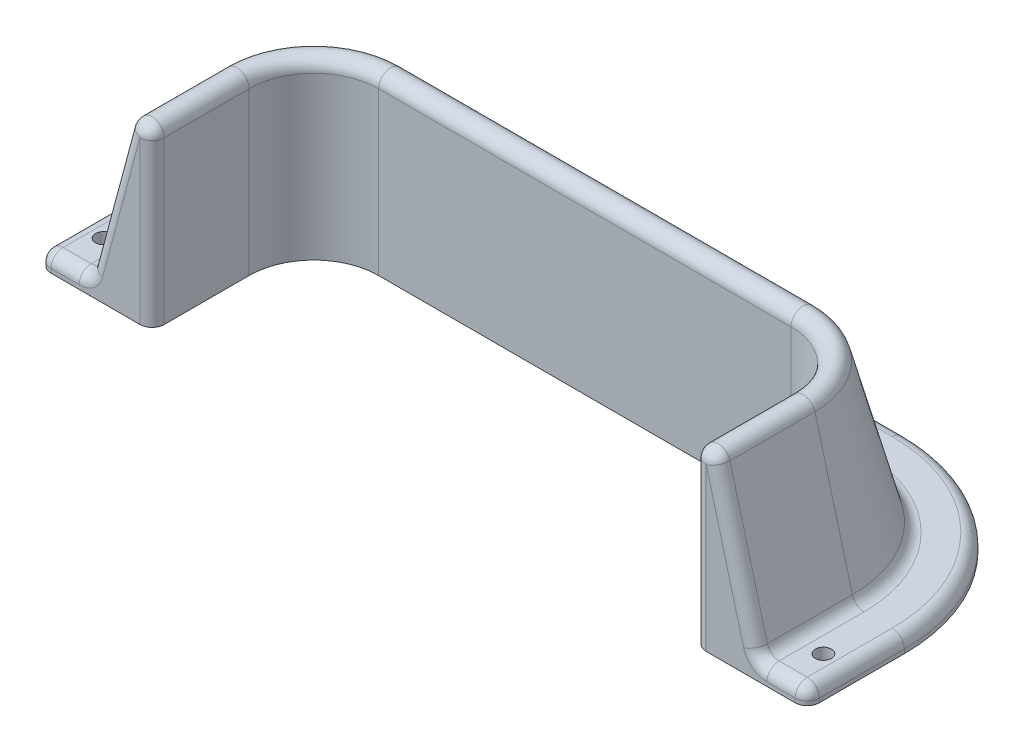
from build123d import *

# Parameters (mm, degrees)
CONG_1_R                = 1.5
ESQUISSE3_R             = 0.9999999999999981
ESQUISSE3_R_2           = 1.0000000000000007
ENL_V_MAT_EXTRU_1_DEPTH = 62.583276982473095


with BuildPart() as part:
    # Balayage1: sweep along a path in Esquisse1
    with BuildLine(Plane(origin=(0, 0, 0), x_dir=(1, 0, 0), z_dir=(0, 1, 0))) as balayage1_path:
        Line((-33.5, 0), (-33.5, 11.999999999999943))
        ThreePointArc((-33.5, 11.999999999999943), (-31.156854249492383, 17.656854249492376), (-25.499999999999947, 20))
        Line((-25.499999999999947, 20), (25.499999999999947, 20))
        ThreePointArc((25.499999999999947, 20), (31.156854249492383, 17.65685424949238), (33.5, 11.999999999999943))
        Line((33.5, 11.999999999999943), (33.5, 0))
    # Esquisse2 → Balayage1 (sweep)
    with BuildSketch(Plane.XY):
        with BuildLine():
            Line((-33.5, 0), (-33.5, 20))
            ThreePointArc((-33.5, 20), (-34.804210711669924, 21.487167292060715), (-36.448888739433606, 20.388228567653773))
            Line((-36.448888739433606, 20.388228567653773), (-41.07810147691004, 3.111771432346228))
            ThreePointArc((-41.07810147691004, 3.111771432346228), (-41.613848072830564, 2.3099699895631494), (-42.52699021634365, 2))
            Line((-42.52699021634365, 2), (-47.5, 2))
            Line((-47.5, 2), (-47.5, 0))
            Line((-47.5, 0), (-33.5, 0))
        make_face()
    sweep(path=balayage1_path.line)

    # Congé1
    cong_1_edges = [part.edges().sort_by_distance(p)[0] for p in [
        (-47.5, 2, -5.999999999999972),
        (-41.056349186103986, 2, -27.556349186104107),
        (1.8119e-13, 2, -33.999999999999666),
        (41.05634918610424, 2, -27.556349186103848),
        (33.5, 10, 0),
        (34.80421071166993, 21.487167292060715, 4.086e-14),
        (38.7634951081718, 11.750000000000082, 1.4287e-13),
        (41.613848072830564, 2.3099699895631502, 2.4514e-13),
        (45.0134951081715, 2, 3.1274e-13),
        (47.5, 1, 3.8014e-13),
        (47.49999999999984, 2, -5.999999999999591),
        (-47.5, 1, 0),
        (-45.013495108171824, 2, 0),
        (-41.613848072830564, 2.3099699895631502, 0),
        (-38.763495108171824, 11.75, 0),
        (-34.80421071166993, 21.487167292060715, 0),
        (-33.5, 10, 0),
    ]]
    fillet(cong_1_edges, radius=CONG_1_R)

    # Esquisse3 → Enlèv. mat.-Extru.1 (cut, through all)
    with BuildSketch(Plane(origin=(0, 2, 0), x_dir=(1, 0, 0), z_dir=(0, 1, 0))):
        with Locations(Location((-44.5, 5, 0), (0, 0, 270))):
            Circle(ESQUISSE3_R)
        with Locations(Location((-18.5, 31.000000000000004, 0), (0, 0, 270))):
            Circle(ESQUISSE3_R_2)
        with Locations(Location((44.5, 5, 0), (0, 0, 90))):
            Circle(ESQUISSE3_R)
        with Locations(Location((18.5, 31.000000000000004, 0), (0, 0, 90))):
            Circle(ESQUISSE3_R_2)
    extrude(amount=-ENL_V_MAT_EXTRU_1_DEPTH, mode=Mode.SUBTRACT)


solid = part.part
